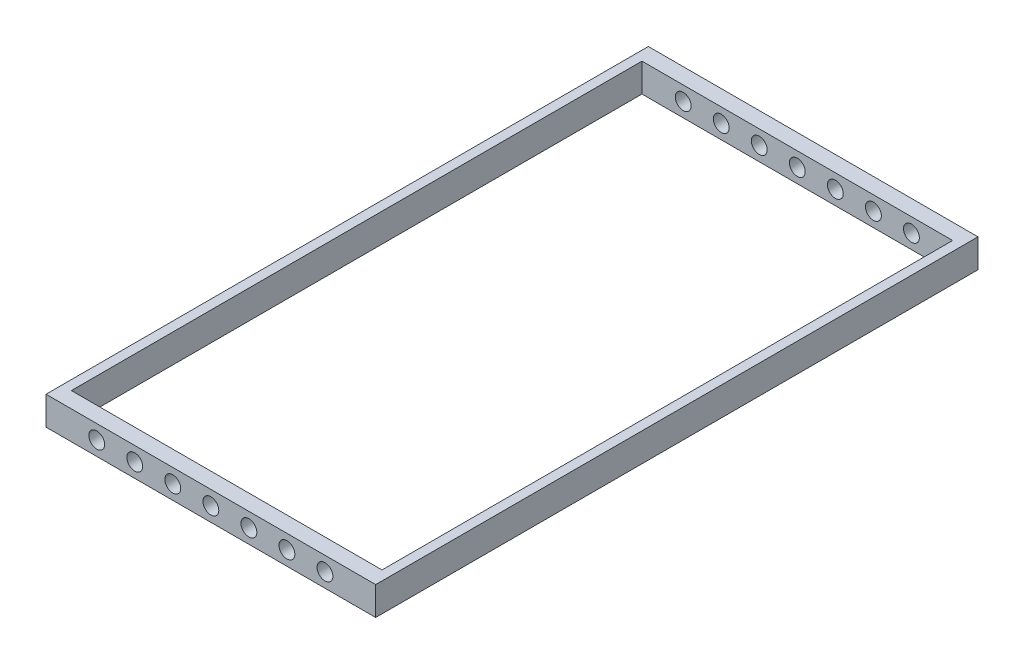
from build123d import *

# Parameters (mm, degrees)
SKETCH_1_W      = 104
SKETCH_1_H      = 9
SKETCH_1_R      = 2.5
EXTRUDE_1_DEPTH = 5
SKETCH_2_W      = 3
SKETCH_2_H      = 9
EXTRUDE_2_DEPTH = 90


with BuildPart() as part:
    # 草圖1 → 填料-伸長1 (new body)
    with BuildSketch(Plane.XY):
        Rectangle(SKETCH_1_W, SKETCH_1_H)
        with Locations((-36, 0)):
            Circle(SKETCH_1_R, mode=Mode.SUBTRACT)
        with Locations((-24, 0)):
            Circle(SKETCH_1_R, mode=Mode.SUBTRACT)
        with Locations((-12, 0)):
            Circle(SKETCH_1_R, mode=Mode.SUBTRACT)
        Circle(SKETCH_1_R, mode=Mode.SUBTRACT)
        with Locations((12, 0)):
            Circle(SKETCH_1_R, mode=Mode.SUBTRACT)
        with Locations((24, 0)):
            Circle(SKETCH_1_R, mode=Mode.SUBTRACT)
        with Locations((36, 0)):
            Circle(SKETCH_1_R, mode=Mode.SUBTRACT)
    extrude_1 = extrude(amount=EXTRUDE_1_DEPTH)

    # 草圖2 → 填料-伸長2 (add)
    with BuildSketch(Plane(origin=(0, 0, 0), x_dir=(-1, 0, 0), z_dir=(0, 0, -1))):
        with Locations((-50.5, 0)):
            Rectangle(SKETCH_2_W, SKETCH_2_H)
        with Locations((50.5, 0)):
            Rectangle(SKETCH_2_W, SKETCH_2_H)
    extrude_2 = extrude(amount=EXTRUDE_2_DEPTH)

    # 鏡射4: 填料-伸長1, 填料-伸長2 across plane
    add(extrude_1.mirror(Plane(origin=(0, 0, -90), x_dir=(1, 0, 0), z_dir=(0, 0, -1))))
    add(extrude_2.mirror(Plane(origin=(0, 0, -90), x_dir=(1, 0, 0), z_dir=(0, 0, -1))))


solid = part.part
